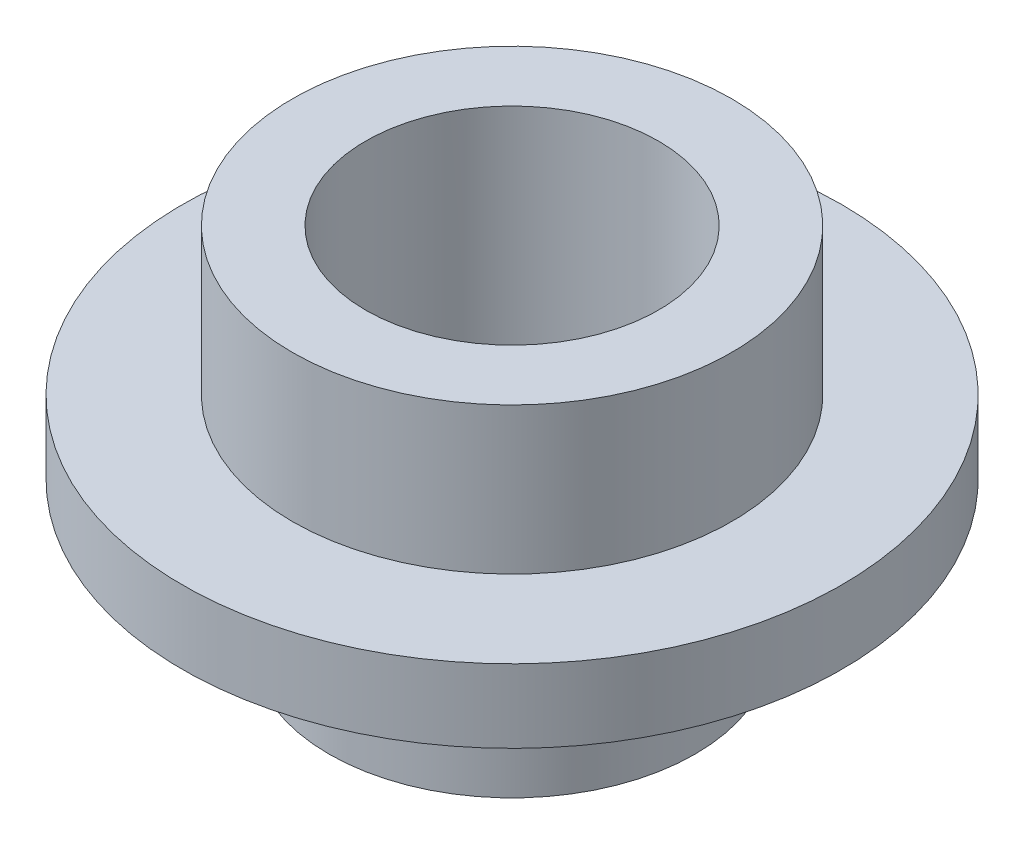
from build123d import *
from build123d.topology import SkipClean

# Parameters (mm, degrees)
SKETCH1_R    = 19.05
SKETCH1_R_2  = 12.7
TOP_DEPTH    = 12.7
MIDDLE_START = 6.35
SKETCH4_R    = 28.575
SKETCH4_R_2  = 12.7
MIDDLE_DEPTH = 6.35
BOTTOM_START = 12.7
SKETCH5_R    = 15.875
SKETCH5_R_2  = 12.7
BOTTOM_DEPTH = 12.7


with BuildPart() as part:
    # Sketch1 → Top (new body)
    with BuildSketch(Plane(origin=(0, 0, 0), x_dir=(1, 0, 0), z_dir=(0, 1, 0))):
        with Locations(Location((0, 0, 0), (0, 0, 270))):
            Circle(SKETCH1_R)
        with Locations(Location((0, 0, 0), (0, 0, 270))):
            Circle(SKETCH1_R_2, mode=Mode.SUBTRACT)
    extrude(amount=TOP_DEPTH)

    # Sketch4 → Middle (add)
    with SkipClean():  # the faces are left unmerged after this step: merging them gives an invalid solid
        with BuildSketch(Plane.XZ.offset(MIDDLE_START)):
            with Locations(Location((0, 0, 0), (0, 0, 270))):
                Circle(SKETCH4_R)
            with Locations(Location((0, 0, 0), (0, 0, 270))):
                Circle(SKETCH4_R_2, mode=Mode.SUBTRACT)
        extrude(amount=-MIDDLE_DEPTH)

    # Sketch5 → Bottom (add)
    with SkipClean():  # the faces are left unmerged after this step: merging them gives an invalid solid
        with BuildSketch(Plane.XZ.offset(6.35).offset(BOTTOM_START)):
            with Locations(Location((0, 0, 0), (0, 0, 270))):
                Circle(SKETCH5_R)
            with Locations(Location((0, 0, 0), (0, 0, 270))):
                Circle(SKETCH5_R_2, mode=Mode.SUBTRACT)
        extrude(amount=-BOTTOM_DEPTH)


solid = part.part
